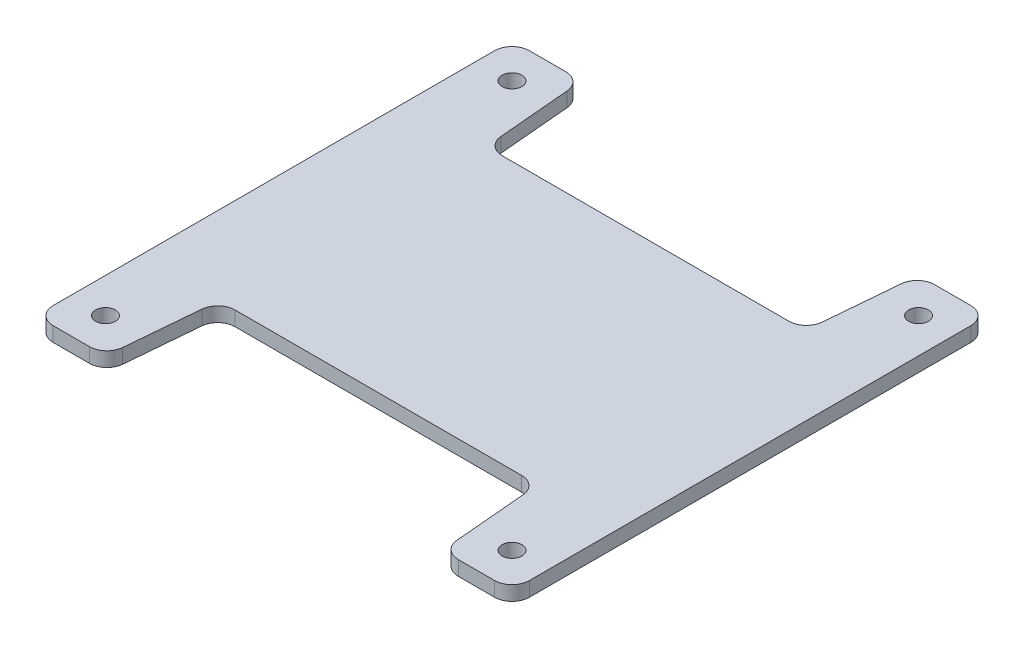
from build123d import *

# Parameters (mm, degrees)
SKETCH1_W            = 82
SKETCH1_H            = 82
BOSS_EXTRUDE1_DEPTH  = 1.25
M3_CLEARANCE_HOLE1_D = 3.4
CUT_EXTRUDE1_DEPTH   = 59.036626366
FILLET1_R            = 3


with BuildPart() as part:
    # Sketch1 → Boss-Extrude1 (new, symmetric)
    with BuildSketch(Plane(origin=(0, 0, 0), x_dir=(1, 0, 0), z_dir=(0, 1, 0))):
        Rectangle(SKETCH1_W, SKETCH1_H)
    extrude(amount=BOSS_EXTRUDE1_DEPTH, both=True)

    # M3 Clearance Hole1 (through all)
    with Locations(Plane(origin=(0, 1.25, 0), x_dir=(1, 0, 0), z_dir=(0, 1, 0))):
        with Locations((35, 35), (-35, -35), (-35, 35), (35, -35)):
            Hole(M3_CLEARANCE_HOLE1_D / 2)

    # Sketch4 → Cut-Extrude1 (cut, through all)
    with BuildSketch(Plane(origin=(0, -1.25, 0), x_dir=(-1, 0, 0), z_dir=(0, -1, 0))):
        Polygon((-29, -41), (29, -41), (27.425204057, -23), (-27.425204057, -23), align=None)
        Polygon((29, 41), (-29, 41), (-27.425204057, 23), (0, 23), (27.425204057, 23), align=None)
    extrude(amount=-CUT_EXTRUDE1_DEPTH, mode=Mode.SUBTRACT)

    # Fillet1
    fillet1_edges = [part.edges().sort_by_distance(p)[0] for p in [
        (29, 0, 41),
        (27.425204057, 0, 23),
        (-27.425204057, 0, 23),
        (-29, 0, 41),
        (-29, 0, -41),
        (-27.425204057, 0, -23),
        (27.425204057, 0, -23),
        (29, 0, -41),
        (-41, 0, -41),
        (41, 0, -41),
        (41, 0, 41),
        (-41, 0, 41),
    ]]
    fillet(fillet1_edges, radius=FILLET1_R)


solid = part.part
